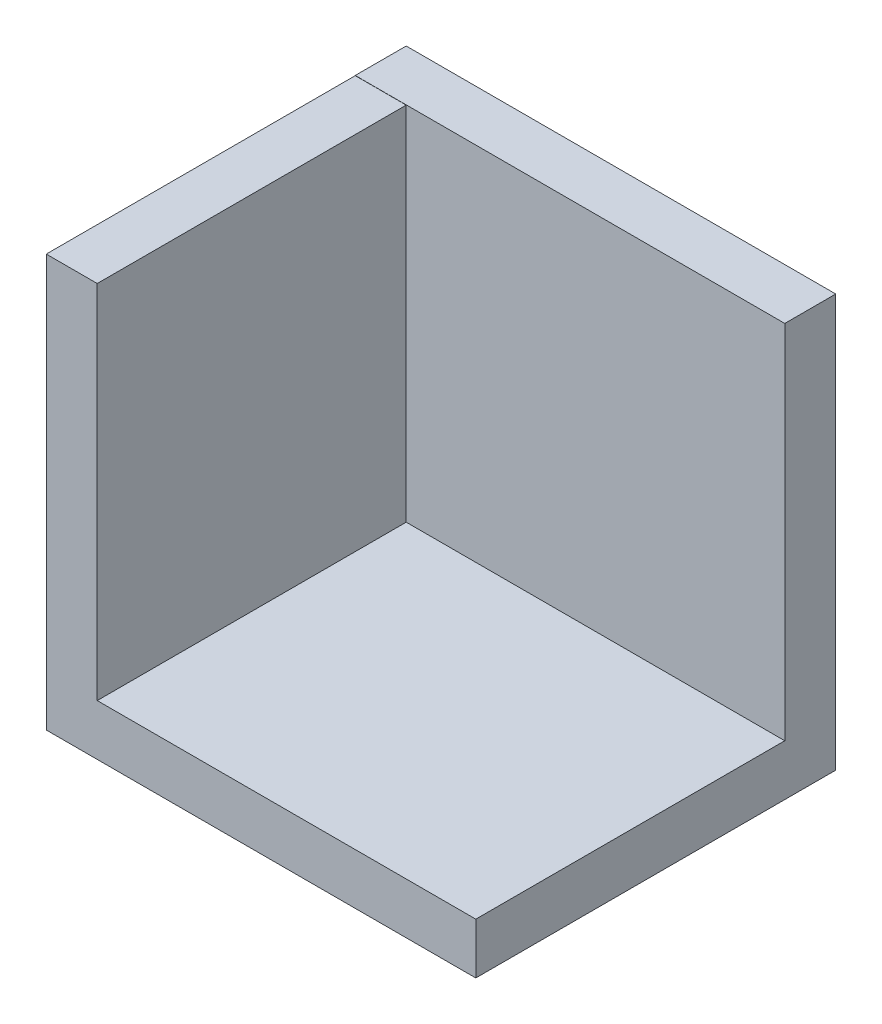
from build123d import *

# Parameters (mm, degrees)
EXTRUDE1_DEPTH = 80.264
SKETCH2_W      = 57.737446173
SKETCH2_H      = 67.495663922
EXTRUDE2_DEPTH = 9.525


with BuildPart() as part:
    # Sketch1 → Extrude1 (new body)
    with BuildSketch(Plane(origin=(0, 0, 0), x_dir=(0, 0, -1), z_dir=(1, 0, 0))):
        Polygon((0, 0), (67.262446173, 0), (67.262446173, 77.060221675), (57.737446173, 77.060221675), (57.737446173, 9.525), (0, 9.525), align=None)
    extrude(amount=-EXTRUDE1_DEPTH)

    # Sketch2 → Extrude2 (add)
    with BuildSketch(Plane.ZY.offset(80.264)):
        with Locations((-28.868723087, 43.272831961)):
            Rectangle(SKETCH2_W, SKETCH2_H)
    extrude(amount=-EXTRUDE2_DEPTH)


solid = part.part
